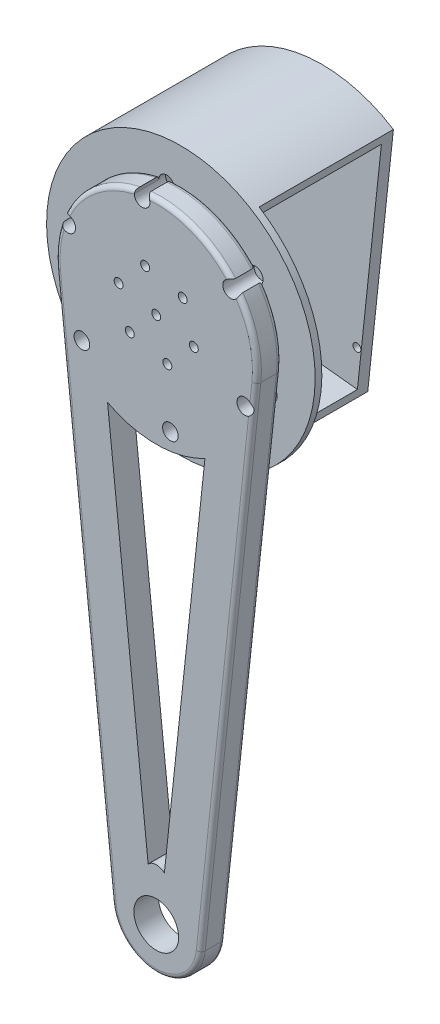
from build123d import *

# Parameters (mm, degrees)
EXTRUDE_1_DEPTH      = 11
SKETCH_2_R           = 10
CUT_EXTRUDE_1_DEPTH  = 11
FILLET_1_R           = 2
CUT_EXTRUDE_2_DEPTH  = 20
SKETCH_6_R           = 2
CUT_EXTRUDE_4_DEPTH  = 33
SKETCH_7_R           = 60
EXTRUDE_2_DEPTH      = 3
SKETCH_8_R           = 3.5
CUT_EXTRUDE_5_DEPTH  = 32
EXTRUDE_3_DEPTH      = 60
CUT_EXTRUDE_START    = -5
CUT_EXTRUDE_6_DEPTH  = 55
SKETCH_11_R          = 1.75
CUT_EXTRUDE_7_DEPTH  = 55
SKETCH_12_W          = 36.740259863
SKETCH_12_H          = 17.192374845
CUT_EXTRUDE_11_DEPTH = 86
SKETCH_13_R          = 2
CUT_EXTRUDE_12_DEPTH = 16


with BuildPart() as part:
    # 草图1 → 凸台-拉伸1 (new body)
    with BuildSketch(Plane.XY):
        with BuildLine():
            Line((-44.744635323, -4.787234043), (-19.886504588, -237.127659574))
            ThreePointArc((-19.886504588, -237.127659574), (0, -255), (19.886504588, -237.127659574))
            Line((19.886504588, -237.127659574), (44.744635323, -4.787234043))
            ThreePointArc((44.744635323, -4.787234043), (0, 45), (-44.744635323, -4.787234043))
        make_face()
    extrude(amount=EXTRUDE_1_DEPTH)

    # 草图2 → 切除-拉伸1 (cut)
    with BuildSketch(Plane(origin=(0, 0, 0), x_dir=(-1, 0, 0), z_dir=(0, 0, -1))):
        with Locations((0, -235.836034695)):
            Circle(SKETCH_2_R)
    extrude(amount=-CUT_EXTRUDE_1_DEPTH, mode=Mode.SUBTRACT)

    # 圆角1
    fillet_1_edges = [part.edges().sort_by_distance(p)[0] for p in [
        (0, -255, 11),
        (32.315569956, -120.957446809, 11),
        (0, 45, 11),
        (32.315569956, -120.957446809, 0),
        (0, -255, 0),
        (-32.315569956, -120.957446809, 0),
        (0, 45, 0),
        (-32.315569956, -120.957446809, 11),
    ]]
    fillet(fillet_1_edges, radius=FILLET_1_R)

    # 草图4 → 切除-拉伸2 (cut)
    with BuildSketch(Plane(origin=(0, 0, 0), x_dir=(-1, 0, 0), z_dir=(0, 0, -1))):
        with BuildLine():
            Line((-21.759824224, -44.682312886), (-3.625991278, -214.173032358))
            ThreePointArc((-3.625991278, -214.173032358), (0.015295132, -212.723088949), (3.615338262, -214.272602446))
            Line((3.615338262, -214.272602446), (21.759824224, -44.682312886))
            ThreePointArc((21.759824224, -44.682312886), (0, -50.060383894), (-21.759824224, -44.682312886))
        make_face()
    extrude(amount=-CUT_EXTRUDE_2_DEPTH, mode=Mode.SUBTRACT)

    # 草图6 → 切除-拉伸4 (cut)
    with BuildSketch(Plane.XY.offset(11)):
        with Locations((-16.789244382, 3.960274368)):
            Circle(SKETCH_6_R)
        with Locations((-4.964923982, 16.52004933)):
            Circle(SKETCH_6_R)
        with Locations((11.8243204, 12.559774961)):
            Circle(SKETCH_6_R)
        with Locations((16.789244382, -3.960274368)):
            Circle(SKETCH_6_R)
        with Locations((4.964923982, -16.52004933)):
            Circle(SKETCH_6_R)
        with Locations((-11.8243204, -12.559774961)):
            Circle(SKETCH_6_R)
    extrude(amount=-CUT_EXTRUDE_4_DEPTH, mode=Mode.SUBTRACT)

    # 草图7 → 凸台-拉伸2 (add)
    with BuildSketch(Plane(origin=(0, 0, 0), x_dir=(-1, 0, 0), z_dir=(0, 0, -1))):
        with Locations(Location((0, 0, 0), (0, 0, 230.326896158))):
            Circle(SKETCH_7_R)
    extrude(amount=EXTRUDE_2_DEPTH)

    # 草图8 → 切除-拉伸5 (cut)
    with BuildSketch(Plane(origin=(0, 0, -3), x_dir=(-1, 0, 0), z_dir=(0, 0, -1))):
        with Locations((-33.230413073, 26.495087223)):
            Circle(SKETCH_8_R)
        with Locations((6.330212074, 42.025925511)):
            Circle(SKETCH_8_R)
        with Locations((39.560625148, 15.530838288)):
            Circle(SKETCH_8_R)
        with Locations((33.230413073, -26.495087223)):
            Circle(SKETCH_8_R)
        with Locations((-6.330212074, -42.025925511)):
            Circle(SKETCH_8_R)
        with Locations((-39.560625148, -15.530838288)):
            Circle(SKETCH_8_R)
    extrude(amount=-CUT_EXTRUDE_5_DEPTH, mode=Mode.SUBTRACT)

    # 草图9 → 凸台-拉伸3 (add)
    with BuildSketch(Plane(origin=(0, 0, -3), x_dir=(-1, 0, 0), z_dir=(0, 0, -1))):
        with BuildLine():
            ThreePointArc((-20.507590524, -56.386511959), (59.659513765, 6.382978723), (-31.972457092, 50.771665203))
            Line((-31.972457092, 50.771665203), (-20.507590524, -56.386511959))
        make_face()
    extrude(amount=EXTRUDE_3_DEPTH)

    # 草图10 → 切除-拉伸6 (cut)
    with BuildSketch(Plane(origin=(0, 0, -63), x_dir=(-1, 0, 0), z_dir=(0, 0, -1)).offset(CUT_EXTRUDE_START)):
        with BuildLine():
            Line((-5.184213658, 50.114065363), (-31.609625433, 47.380402076))
            Line((-31.609625433, 47.380402076), (-20.880322571, -52.902713303))
            Line((-20.880322571, -52.902713303), (5.184213658, -50.114065363))
            ThreePointArc((5.184213658, -50.114065363), (50.114065363, 5.184213658), (-5.184213658, 50.114065363))
        make_face()
    extrude(amount=-CUT_EXTRUDE_6_DEPTH, mode=Mode.SUBTRACT)

    # 草图11 → 切除-拉伸7 (cut)
    with BuildSketch(Plane(origin=(0, 0, -63), x_dir=(-1, 0, 0), z_dir=(0, 0, -1))):
        with Locations((21.028743793, 37.355792769)):
            Circle(SKETCH_11_R)
        with Locations((41.110231265, 11.766525216)):
            Circle(SKETCH_11_R)
        with Locations((37.21564262, -20.527575364)):
            Circle(SKETCH_11_R)
        with Locations((11.626375067, -40.609062835)):
            Circle(SKETCH_11_R)
        with Locations((-20.667725513, -36.714474191)):
            Circle(SKETCH_11_R)
        with Locations((-40.749212984, -11.125206638)):
            Circle(SKETCH_11_R)
        with Locations((-36.854624339, 21.168893942)):
            Circle(SKETCH_11_R)
        with Locations((-11.265356786, 41.250381414)):
            Circle(SKETCH_11_R)
    extrude(amount=-CUT_EXTRUDE_7_DEPTH, mode=Mode.SUBTRACT)

    # 草图12 → 切除-拉伸11 (cut)
    with BuildSketch(Plane(origin=(0, 0, 0), x_dir=(1, 0, 0), z_dir=(0, 1, 0))):
        with Locations((8.539402802, 11.596187422)):
            Rectangle(SKETCH_12_W, SKETCH_12_H)
    extrude(amount=-CUT_EXTRUDE_11_DEPTH, mode=Mode.SUBTRACT)

    # 草图13 → 切除-拉伸12 (cut)
    with BuildSketch(Plane(origin=(0, 0, -3), x_dir=(-1, 0, 0), z_dir=(0, 0, -1))):
        Circle(SKETCH_13_R)
    extrude(amount=-CUT_EXTRUDE_12_DEPTH, mode=Mode.SUBTRACT)


solid = part.part
